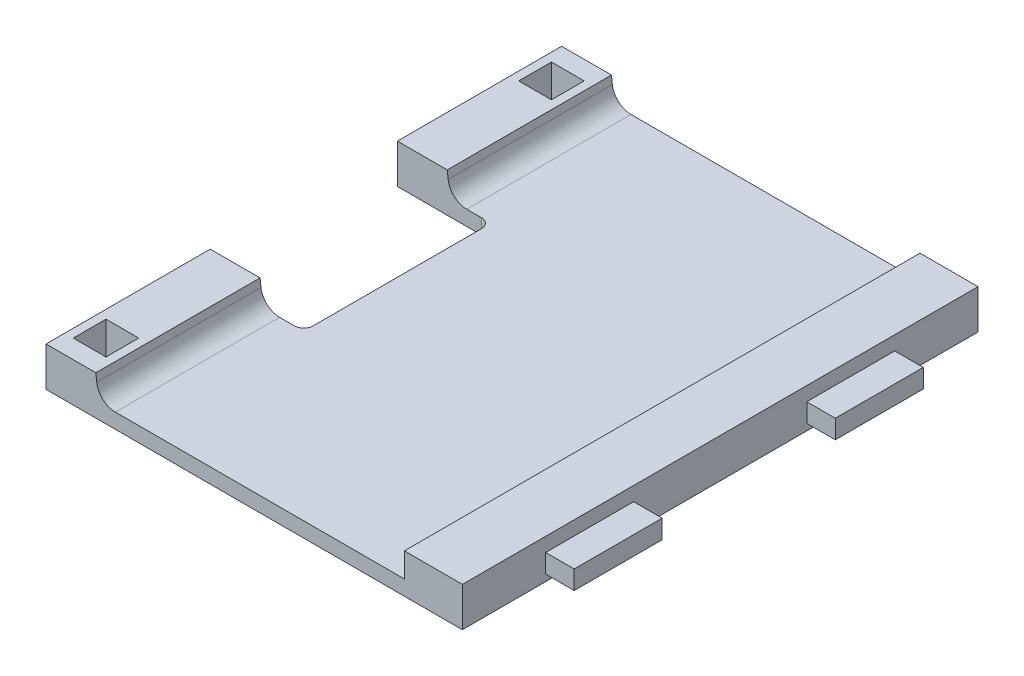
from build123d import *

# Parameters (mm, degrees)
RESSALTO_EXTRUS_O1_DEPTH = 55.1
ESBO_O5_W                = 9.4
ESBO_O5_H                = 2
RESSALTO_EXTRUS_O2_DEPTH = 3.05
ESBO_O8_W                = 3.5
ESBO_O8_H                = 3.5
CORTE_EXTRUS_O6_DEPTH    = 3.5
ESBO_O9_W                = 10
ESBO_O9_H                = 20
CORTE_EXTRUS_O7_DEPTH    = 71.482001249
FILETE1_R                = 1


with BuildPart() as part:
    # Esboço1 → Ressalto-extrusão1 (new body)
    with BuildSketch(Plane.XY):
        with BuildLine():
            Line((0, 0), (40.7, 0))
            Line((40.7, 0), (40.7, 4.2))
            Line((40.7, 4.2), (34.5, 4.2))
            Line((34.5, 4.2), (34.5, 1.6))
            Line((34.5, 1.6), (3.614566097, 1.6))
            ThreePointArc((3.614566097, 1.6), (2.284269322, 2.106577592), (1.627871083, 3.369689511))
            Line((1.627871083, 3.369689511), (1.531616141, 4.2))
            Line((1.531616141, 4.2), (-3.796013859, 4.2))
            Line((-3.796013859, 4.2), (-3.796013859, 0))
            Line((-3.796013859, 0), (0, 0))
        make_face()
    extrude(amount=RESSALTO_EXTRUS_O1_DEPTH)

    # Esboço5 → Ressalto-extrusão2 (add)
    with BuildSketch(Plane(origin=(40.7, 0, 0), x_dir=(0, 0, -1), z_dir=(1, 0, 0))):
        with Locations((-13.6, 1.7)):
            Rectangle(ESBO_O5_W, ESBO_O5_H)
        with Locations((-41.5, 1.7)):
            Rectangle(ESBO_O5_W, ESBO_O5_H)
    extrude(amount=RESSALTO_EXTRUS_O2_DEPTH)

    # Esboço8 → Corte-extrusão6 (cut)
    with BuildSketch(Plane(origin=(0, 4.2, 0), x_dir=(1, 0, 0), z_dir=(0, 1, 0))):
        with Locations((-1.132198859, -51.35)):
            Rectangle(ESBO_O8_W, ESBO_O8_H)
        with Locations((-1.132198859, -3.75)):
            Rectangle(ESBO_O8_W, ESBO_O8_H)
    extrude(amount=-CORTE_EXTRUS_O6_DEPTH, mode=Mode.SUBTRACT)

    # Esboço9 → Corte-extrusão7 (cut, through all)
    with BuildSketch(Plane.XZ):
        with Locations((1.203986141, 27.55)):
            Rectangle(ESBO_O9_W, ESBO_O9_H)
    extrude(amount=-CORTE_EXTRUS_O7_DEPTH, mode=Mode.SUBTRACT)

    # Filete1
    filete1_edges = [part.edges().sort_by_distance(p)[0] for p in [
        (6.203986141, 0.8, 37.55),
        (6.203986141, 0.8, 17.55),
    ]]
    fillet(filete1_edges, radius=FILETE1_R)


solid = part.part
